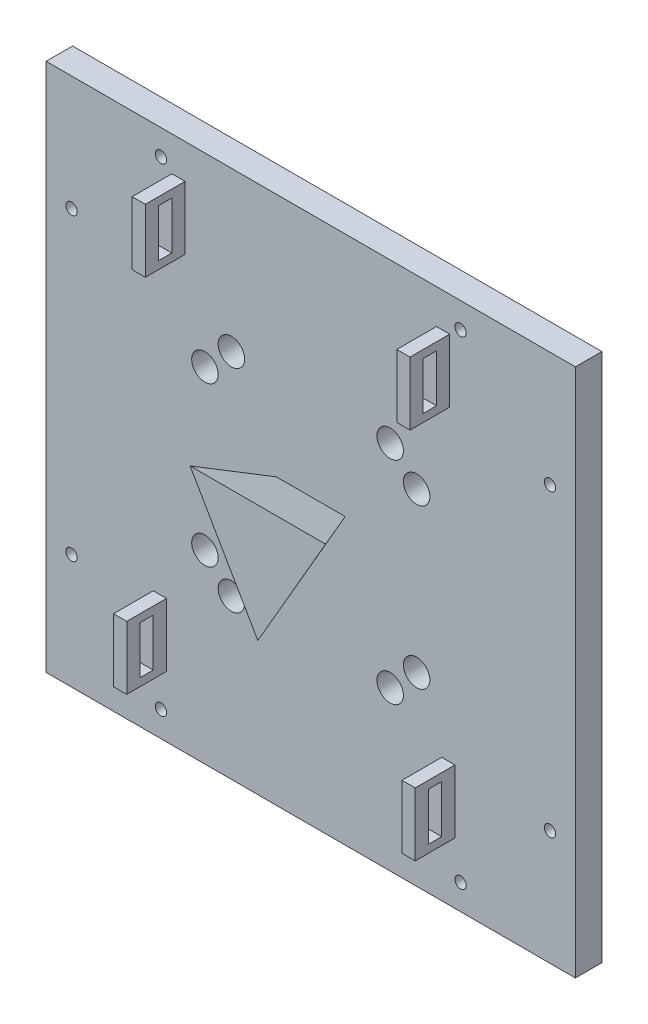
from build123d import *

# Parameters (mm, degrees)
SKETCH1_W               = 200
SKETCH1_H               = 200
BOSS_EXTRUDE1_DEPTH     = 10
SKETCH2_R               = 5
SKETCH2_R_2             = 2.15
CUT_EXTRUDE1_DEPTH      = 142.774468788
BOSS_EXTRUDE2_DEPTH     = 20
DRAFT3_ANGLE            = -20
SKETCH6_W               = 5
SKETCH6_H               = 23.898224132
BOSS_EXTRUDE3_DEPTH     = 15
CUT_EXTRUDE3_DEPTH      = 185.814095783
CUT_EXTRUDE3_DEPTH_BACK = 185.814095783
SKETCH7_W               = 5
SKETCH7_H               = 18


with BuildPart() as part:
    # Sketch1 → Boss-Extrude1 (new body)
    with BuildSketch(Plane.XY):
        Rectangle(SKETCH1_W, SKETCH1_H)
    extrude(amount=BOSS_EXTRUDE1_DEPTH)

    # Sketch2 → Cut-Extrude1 (cut, through all)
    with BuildSketch(Plane.XY.offset(10)):
        with Locations((-40, 30)):
            Circle(SKETCH2_R)
        with Locations((40, 30)):
            Circle(SKETCH2_R)
        with Locations((40, -30)):
            Circle(SKETCH2_R)
        with Locations((-40, -30)):
            Circle(SKETCH2_R)
        with Locations((-30, 40)):
            Circle(SKETCH2_R)
        with Locations((30, 40)):
            Circle(SKETCH2_R)
        with Locations((30, -40)):
            Circle(SKETCH2_R)
        with Locations((-30, -40)):
            Circle(SKETCH2_R)
        with Locations((-56.6, 90.4)):
            Circle(SKETCH2_R_2)
        with Locations((-90.4, 56.6)):
            Circle(SKETCH2_R_2)
        with Locations((-90.4, -56.6)):
            Circle(SKETCH2_R_2)
        with Locations((-56.6, -90.4)):
            Circle(SKETCH2_R_2)
        with Locations((56.6, -90.4)):
            Circle(SKETCH2_R_2)
        with Locations((90.4, -56.6)):
            Circle(SKETCH2_R_2)
        with Locations((90.4, 56.6)):
            Circle(SKETCH2_R_2)
        with Locations((56.6, 90.4)):
            Circle(SKETCH2_R_2)
    extrude(amount=-CUT_EXTRUDE1_DEPTH, mode=Mode.SUBTRACT)

    # Sketch4 → Boss-Extrude2 (add)
    with BuildSketch(Plane.XY.offset(10)):
        Polygon((0, -15), (12.990381057, 7.5), (-12.990381057, 7.5), align=None)
    extrude(amount=BOSS_EXTRUDE2_DEPTH)

    # Draft3
    draft3_faces = [part.faces().sort_by_distance(p)[0] for p in [
        (0, 7.5, 20),
        (-6.495190528, -3.75, 20),
        (6.495190528, -3.75, 20),
    ]]
    draft(draft3_faces, Plane.XY.offset(10), DRAFT3_ANGLE)

    # Sketch6 → Boss-Extrude3 (add)
    with BuildSketch(Plane.XY.offset(10)):
        with Locations((50, 75)):
            Rectangle(SKETCH6_W, SKETCH6_H)
        with Locations((-50, 75)):
            Rectangle(SKETCH6_W, SKETCH6_H)
        with Locations((-57.033087887, -65)):
            Rectangle(SKETCH6_W, SKETCH6_H)
        with Locations((51.971023082, -65)):
            Rectangle(SKETCH6_W, SKETCH6_H)
    extrude(amount=BOSS_EXTRUDE3_DEPTH)

    # Sketch7 → Cut-Extrude3 (cut, two sides: drawn at the far end of the back side and taken through both)
    with BuildSketch(Plane(origin=(52.5, 0, 0), x_dir=(0, 0, -1), z_dir=(1, 0, 0)).offset(-CUT_EXTRUDE3_DEPTH_BACK)):
        with Locations((-17.5, 75)):
            Rectangle(SKETCH7_W, SKETCH7_H)
        with Locations((-17.5, -65)):
            Rectangle(SKETCH7_W, SKETCH7_H)
    extrude(amount=CUT_EXTRUDE3_DEPTH + CUT_EXTRUDE3_DEPTH_BACK, mode=Mode.SUBTRACT)


solid = part.part
